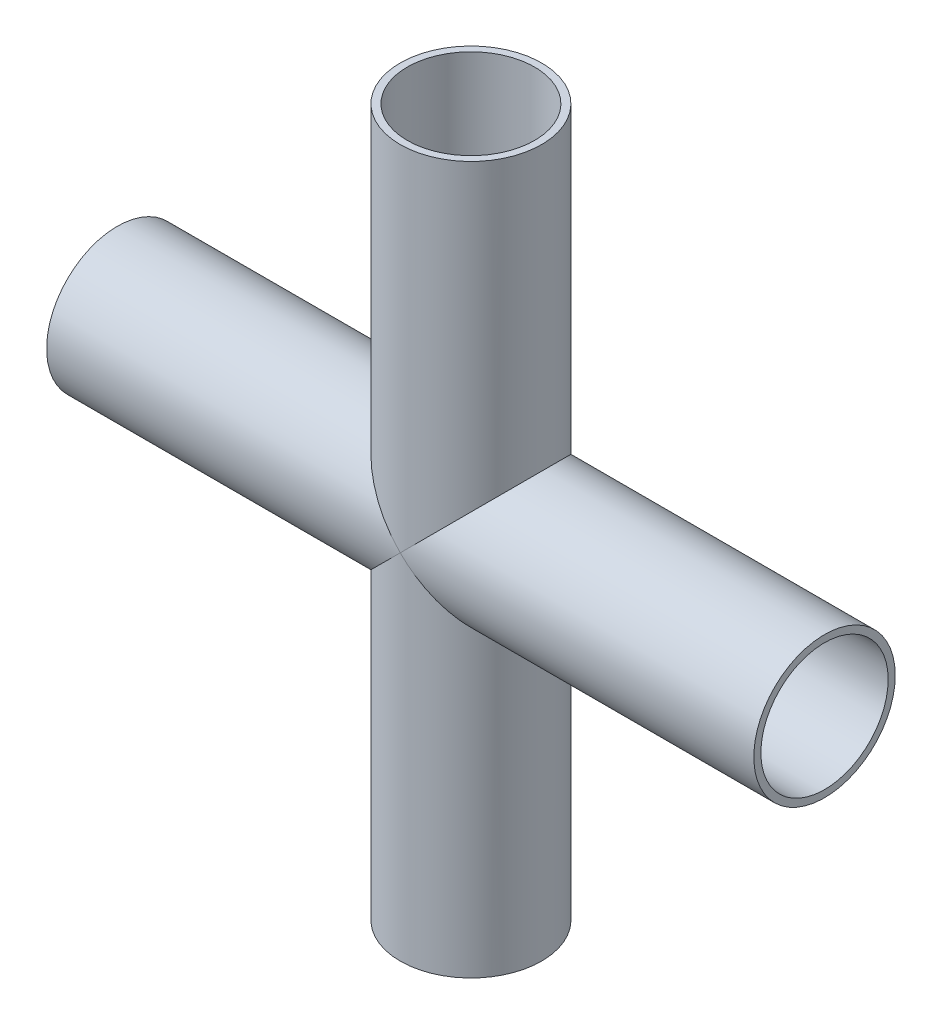
from build123d import *
from build123d.topology import SkipClean

# Parameters (mm, degrees)
SKETCH1_R           = 1
SKETCH1_R_2         = 0.9
BOSS_EXTRUDE1_DEPTH = 10
SKETCH2_R           = 1
SKETCH2_R_2         = 0.9
BOSS_EXTRUDE2_DEPTH = 5
SKETCH4_R           = 0.9
CUT_EXTRUDE2_DEPTH  = 12.224972294
SKETCH5_R           = 0.9
CUT_EXTRUDE3_DEPTH  = 15.17744702


with BuildPart() as part:
    # Sketch1 → Boss-Extrude1 (new body)
    with BuildSketch(Plane(origin=(0, 0, 0), x_dir=(1, 0, 0), z_dir=(0, 1, 0))):
        with Locations(Location((0, 0, 0), (0, 0, 270))):
            Circle(SKETCH1_R)
        with Locations(Location((0, 0, 0), (0, 0, 270))):
            Circle(SKETCH1_R_2, mode=Mode.SUBTRACT)
    extrude(amount=BOSS_EXTRUDE1_DEPTH)

    # Sketch2 → Boss-Extrude2 (add, symmetric)
    with BuildSketch(Plane(origin=(0, 0, 0), x_dir=(0, 0, -1), z_dir=(1, 0, 0))):
        with Locations((0, 5)):
            Circle(SKETCH2_R)
        with Locations(Location((0, 5, 0), (0, 0, 180))):
            Circle(SKETCH2_R_2, mode=Mode.SUBTRACT)
    extrude(amount=BOSS_EXTRUDE2_DEPTH, both=True)

    # Sketch4 → Cut-Extrude2 (cut, through all)
    with BuildSketch(Plane.XZ):
        with Locations(Location((0, 0, 0), (0, 0, 90))):
            Circle(SKETCH4_R)
    extrude(amount=-CUT_EXTRUDE2_DEPTH, mode=Mode.SUBTRACT)

    # Sketch5 → Cut-Extrude3 (cut, through all)
    with SkipClean():  # the faces are left unmerged after this step: merging them gives an invalid solid
        with BuildSketch(Plane(origin=(5, 0, 0), x_dir=(0, 0, -1), z_dir=(1, 0, 0))):
            with Locations((0, 5)):
                Circle(SKETCH5_R)
        extrude(amount=-CUT_EXTRUDE3_DEPTH, mode=Mode.SUBTRACT)


solid = part.part
